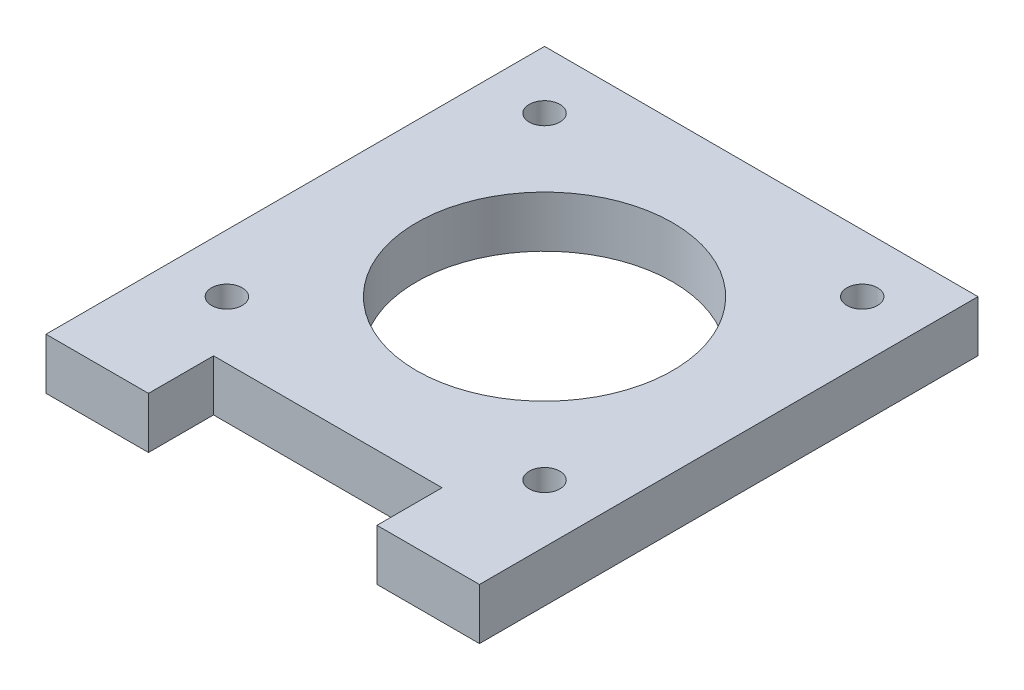
from build123d import *

# Parameters (mm, degrees)
SKETCH1_R           = 12.5
SKETCH1_R_2         = 1.5
BOSS_EXTRUDE1_DEPTH = 2.5


with BuildPart() as part:
    # Sketch1 → Boss-Extrude1 (new, symmetric)
    with BuildSketch(Plane(origin=(0, 0, 0), x_dir=(1, 0, 0), z_dir=(0, 1, 0))):
        Polygon((-21.15, -21.15), (-21.15, -27.5), (-11.15, -27.5), (-11.15, -21.15), (11.15, -21.15), (11.15, -27.5), (21.15, -27.5), (21.15, -21.15), (21.15, 21.15), (-21.15, 21.15), align=None)
        with Locations(Location((0, 0, 0), (0, 0, 270))):
            Circle(SKETCH1_R, mode=Mode.SUBTRACT)
        with Locations(Location((-15.5, 15.5, 0), (0, 0, 270))):
            Circle(SKETCH1_R_2, mode=Mode.SUBTRACT)
        with Locations(Location((15.5, 15.5, 0), (0, 0, 270))):
            Circle(SKETCH1_R_2, mode=Mode.SUBTRACT)
        with Locations(Location((15.5, -15.5, 0), (0, 0, 270))):
            Circle(SKETCH1_R_2, mode=Mode.SUBTRACT)
        with Locations(Location((-15.5, -15.5, 0), (0, 0, 270))):
            Circle(SKETCH1_R_2, mode=Mode.SUBTRACT)
    extrude(amount=BOSS_EXTRUDE1_DEPTH, both=True)


solid = part.part
